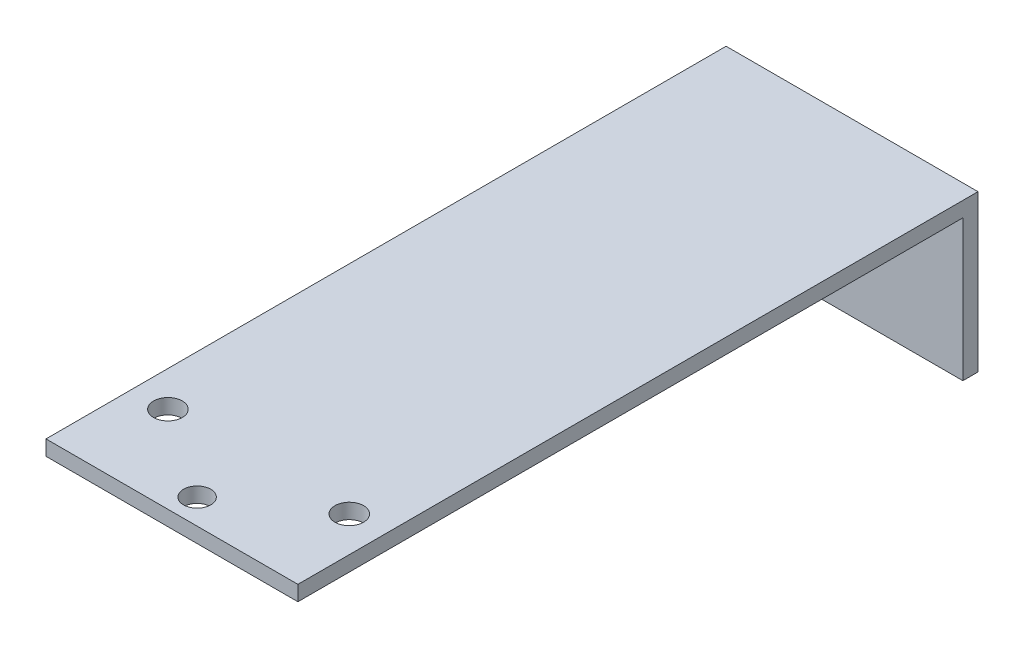
from build123d import *

# Parameters (mm, degrees)
SKETCH1_W           = 50
SKETCH1_H           = 135
BOSS_EXTRUDE1_DEPTH = 3
SKETCH2_W           = 50
SKETCH2_H           = 3
BOSS_EXTRUDE2_DEPTH = 28
SKETCH3_R           = 2.7
CUT_EXTRUDE1_DEPTH  = 90
SKETCH5_R           = 2.85
CUT_EXTRUDE2_DEPTH  = 90


with BuildPart() as part:
    # Sketch1 → Boss-Extrude1 (new body)
    with BuildSketch(Plane(origin=(0, 0, 0), x_dir=(1, 0, 0), z_dir=(0, 1, 0))):
        with Locations((-22.439180538, -11.987836108)):
            Rectangle(SKETCH1_W, SKETCH1_H)
    extrude(amount=BOSS_EXTRUDE1_DEPTH)

    # Sketch2 → Boss-Extrude2 (add)
    with BuildSketch(Plane.XZ):
        with Locations((-22.439180538, -54.012163892)):
            Rectangle(SKETCH2_W, SKETCH2_H)
    extrude(amount=BOSS_EXTRUDE2_DEPTH)

    # Sketch3 → Cut-Extrude1 (cut)
    with BuildSketch(Plane.XZ):
        with Locations(Location((-22.439180538, 74.487836108, 0), (0, 0, 270))):
            Circle(SKETCH3_R)
    extrude(amount=-CUT_EXTRUDE1_DEPTH, mode=Mode.SUBTRACT)

    # Sketch5 → Cut-Extrude2 (cut)
    with BuildSketch(Plane.XZ):
        with Locations(Location((-40.439180538, 62.287836108, 0), (0, 0, 270))):
            Circle(SKETCH5_R)
        with Locations(Location((-4.439180538, 62.287836108, 0), (0, 0, 270))):
            Circle(SKETCH5_R)
    extrude(amount=-CUT_EXTRUDE2_DEPTH, mode=Mode.SUBTRACT)


solid = part.part
